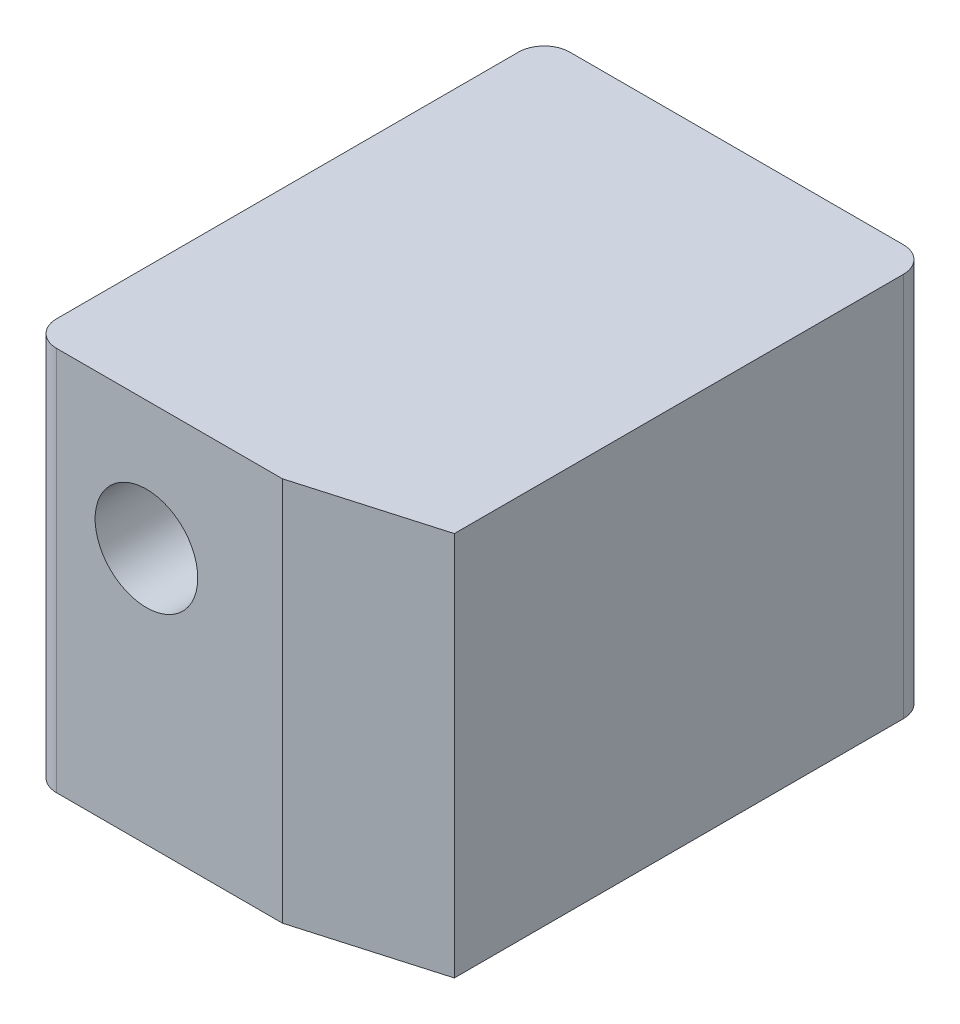
from build123d import *

# Parameters (mm, degrees)
BOSS_EXTRU_1_DEPTH      = 15
ESQUISSE2_R             = 2
ENL_V_MAT_EXTRU_1_DEPTH = 12
ESQUISSE3_R             = 2
ENL_V_MAT_EXTRU_2_DEPTH = 12
CONG_1_R                = 1
ENL_V_MAT_EXTRU_3_REACH = 28.101


with BuildPart() as part:
    # Esquisse1 → Boss.-Extru.1 (new body)
    with BuildSketch(Plane(origin=(0, 0, 0), x_dir=(1, 0, 0), z_dir=(0, 1, 0))):
        Polygon((0, 0), (7.5, 0), (7.5, 20), (-7.5, 20), (-7.5, 0), align=None)
    extrude(amount=BOSS_EXTRU_1_DEPTH)

    # Esquisse2 → Enlèv. mat.-Extru.1 (cut)
    with BuildSketch(Plane.XZ):
        with Locations(Location((-3, -16, 0), (0, 0, 270))):
            Circle(ESQUISSE2_R)
        with Locations(Location((3, -4, 0), (0, 0, 270))):
            Circle(ESQUISSE2_R)
    extrude(amount=-ENL_V_MAT_EXTRU_1_DEPTH, mode=Mode.SUBTRACT)

    # Esquisse3 → Enlèv. mat.-Extru.2 (cut)
    with BuildSketch(Plane.XY):
        with Locations((-3, 10)):
            Circle(ESQUISSE3_R)
    extrude(amount=-ENL_V_MAT_EXTRU_2_DEPTH, mode=Mode.SUBTRACT)

    # Congé1
    cong_1_edges = [part.edges().sort_by_distance(p)[0] for p in [
        (-7.5, 7.5, 0),
        (-7.5, 7.5, -20),
        (7.5, 7.5, -20),
    ]]
    fillet(cong_1_edges, radius=CONG_1_R)

    # Esquisse5 → Enlèv. mat.-Extru.3 (cut, up to next)
    with BuildSketch(Plane(origin=(0, 15, 0), x_dir=(1, 0, 0), z_dir=(0, 1, 0)), mode=Mode.PRIVATE) as enl_v_mat_extru_3_sk1:
        Polygon((7.5, 0), (2.3, 0), (7.5, 1.5), align=None)
    enl_v_mat_extru_3_tool1 = extrude(enl_v_mat_extru_3_sk1.sketch, amount=-ENL_V_MAT_EXTRU_3_REACH, mode=Mode.PRIVATE) & part.part
    add(enl_v_mat_extru_3_tool1.solids().sort_by_distance((5.766667, 15, -0.5))[0], mode=Mode.SUBTRACT)


solid = part.part
